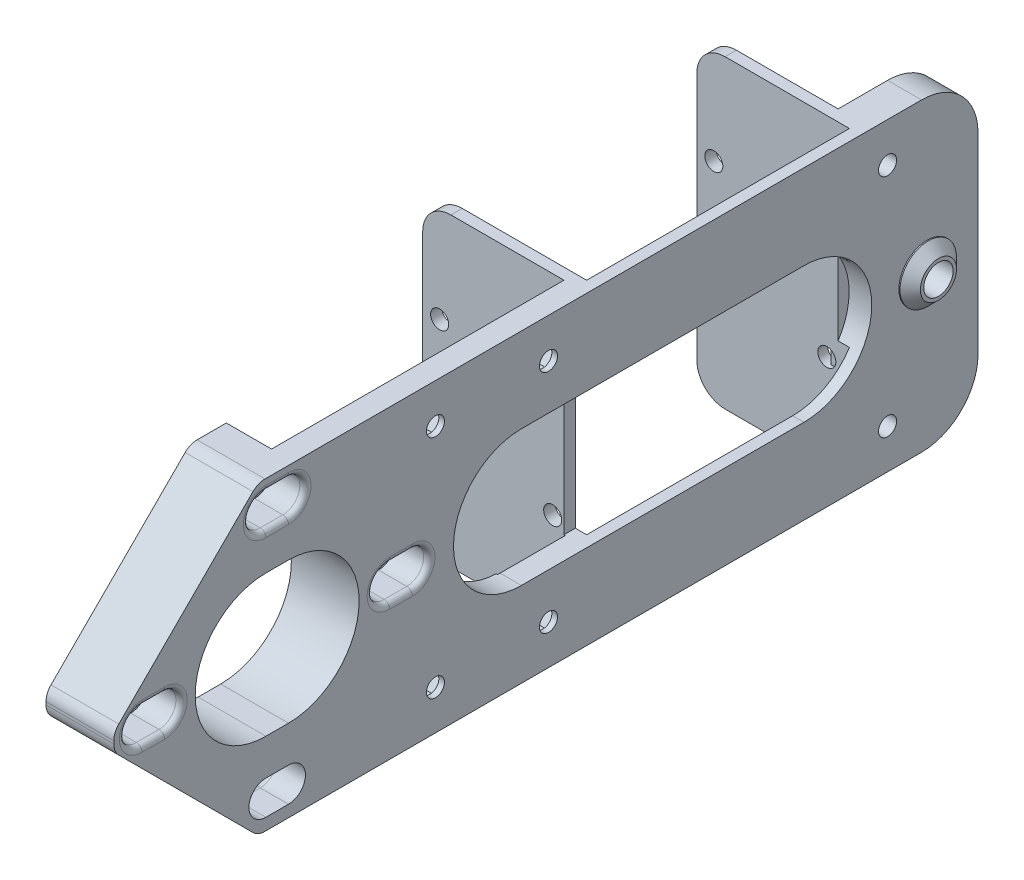
from build123d import *

# Parameters (mm, degrees)
SKETCH1_W                        = 54
SKETCH1_H                        = 154
BOSS_EXTRUDE1_DEPTH              = 2
BOSS_EXTRUDE11_REACH             = 125.016
SKETCH24_W                       = 27
SKETCH24_H                       = 2
BOSS_EXTRUDE11_DIRECTION_2_REACH = 125.016
CUT_EXTRUDE13_REACH              = 94.955
SKETCH25_R                       = 1.6
BOSS_EXTRUDE6_DEPTH              = 10
SKETCH19_W                       = 54
SKETCH19_H                       = 20
BOSS_EXTRUDE9_DEPTH              = 4
SKETCH26_W                       = 54
SKETCH26_H                       = 84.75
SKETCH26_H_2                     = 18.75
BOSS_EXTRUDE12_DEPTH             = 2
CUT_EXTRUDE3_REACH               = 128.372
SKETCH8_R                        = 1.6
CUT_EXTRUDE7_DEPTH               = 3
SKETCH18_R                       = 2.6
CUT_EXTRUDE9_DEPTH               = 6
BOSS_EXTRUDE10_START             = -2
SKETCH20_R                       = 5
SKETCH20_R_2                     = 2.6
BOSS_EXTRUDE10_DEPTH             = 2
CHAMFER3_SIZE                    = 1.8
CUT_EXTRUDE10_DEPTH              = 2.6
CUT_EXTRUDE11_DEPTH              = 4
CUT_EXTRUDE4_DEPTH               = 12
CUT_EXTRUDE5_DEPTH               = 6
FILLET6_R                        = 3
FILLET7_R                        = 1
CUT_EXTRUDE12_START              = -4
CUT_EXTRUDE12_DEPTH              = 4
SKETCH27_R                       = 3
CUT_EXTRUDE14_DEPTH              = 12
CUT_EXTRUDE15_START              = 19
SKETCH28_R                       = 3
CUT_EXTRUDE15_DEPTH              = 19
FILLET8_R                        = 5
FILLET9_R                        = 10


with BuildPart() as part:
    # Sketch1 → Boss-Extrude1 (new body)
    with BuildSketch(Plane.YZ):
        with Locations((0, 43)):
            Rectangle(SKETCH1_W, SKETCH1_H)
    extrude(amount=BOSS_EXTRUDE1_DEPTH)

    # Boss-Extrude11: up to this face of the body (flat: up to its plane)
    boss_extrude11_end = Plane(part.part.faces().sort_by_distance((1, 27, 43))[0])
    # Sketch24 → Boss-Extrude11 (add, up to the picked face)
    with BuildSketch(Plane(origin=(0, 0, 0), x_dir=(-1, 0, 0), z_dir=(0, 1, 0)), mode=Mode.PRIVATE) as boss_extrude11_sk1:
        with Locations((13.5, 34.25)):
            Rectangle(SKETCH24_W, SKETCH24_H)
    boss_extrude11_tool1 = split(extrude(boss_extrude11_sk1.sketch, amount=BOSS_EXTRUDE11_REACH, mode=Mode.PRIVATE), bisect_by=boss_extrude11_end, keep=Keep.BOTH, mode=Mode.PRIVATE)
    # Sketch24 → Boss-Extrude11 (add, up to the picked face)
    with BuildSketch(Plane(origin=(0, 0, 0), x_dir=(-1, 0, 0), z_dir=(0, 1, 0)), mode=Mode.PRIVATE) as boss_extrude11_sk2:
        with Locations((13.5, -14.25)):
            Rectangle(SKETCH24_W, SKETCH24_H)
    boss_extrude11_tool2 = split(extrude(boss_extrude11_sk2.sketch, amount=BOSS_EXTRUDE11_REACH, mode=Mode.PRIVATE), bisect_by=boss_extrude11_end, keep=Keep.BOTH, mode=Mode.PRIVATE)
    add(boss_extrude11_tool1.solids().sort_by(Axis((-13.5, 0, 34.25), (0, 1, 0)))[0])
    add(boss_extrude11_tool2.solids().sort_by(Axis((-13.5, 0, -14.25), (0, 1, 0)))[0])

    # Boss-Extrude11 direction 2: up to this face of the body (flat: up to its plane)
    boss_extrude11_direction_2_end = Plane(part.part.faces().sort_by_distance((1, -27, 43))[0])
    # Sketch24 → Boss-Extrude11 direction 2 (add, up to the picked face)
    with BuildSketch(Plane(origin=(0, 0, 0), x_dir=(-1, 0, 0), z_dir=(0, 1, 0)), mode=Mode.PRIVATE) as boss_extrude11_direction_2_sk1:
        with Locations((13.5, 34.25)):
            Rectangle(SKETCH24_W, SKETCH24_H)
    boss_extrude11_direction_2_tool1 = split(extrude(boss_extrude11_direction_2_sk1.sketch, amount=-BOSS_EXTRUDE11_DIRECTION_2_REACH, mode=Mode.PRIVATE), bisect_by=boss_extrude11_direction_2_end, keep=Keep.BOTH, mode=Mode.PRIVATE)
    # Sketch24 → Boss-Extrude11 direction 2 (add, up to the picked face)
    with BuildSketch(Plane(origin=(0, 0, 0), x_dir=(-1, 0, 0), z_dir=(0, 1, 0)), mode=Mode.PRIVATE) as boss_extrude11_direction_2_sk2:
        with Locations((13.5, -14.25)):
            Rectangle(SKETCH24_W, SKETCH24_H)
    boss_extrude11_direction_2_tool2 = split(extrude(boss_extrude11_direction_2_sk2.sketch, amount=-BOSS_EXTRUDE11_DIRECTION_2_REACH, mode=Mode.PRIVATE), bisect_by=boss_extrude11_direction_2_end, keep=Keep.BOTH, mode=Mode.PRIVATE)
    add(boss_extrude11_direction_2_tool1.solids().sort_by(Axis((-13.5, 0, 34.25), (0, -1, 0)))[0])
    add(boss_extrude11_direction_2_tool2.solids().sort_by(Axis((-13.5, 0, -14.25), (0, -1, 0)))[0])

    # Cut-Extrude13: up to this face of the body (flat: up to its plane)
    cut_extrude13_end = Plane(part.part.faces().sort_by_distance((-13.5, 0, -15.25))[0])
    # Sketch25 → Cut-Extrude13 (cut, up to the picked face)
    with BuildSketch(Plane.XY.offset(35.25), mode=Mode.PRIVATE) as cut_extrude13_sk1:
        with Locations((-24, 10)):
            Circle(SKETCH25_R)
    cut_extrude13_tool1 = split(extrude(cut_extrude13_sk1.sketch, amount=-CUT_EXTRUDE13_REACH, mode=Mode.PRIVATE), bisect_by=cut_extrude13_end, keep=Keep.BOTH, mode=Mode.PRIVATE)
    # Sketch25 → Cut-Extrude13 (cut, up to the picked face)
    with BuildSketch(Plane.XY.offset(35.25), mode=Mode.PRIVATE) as cut_extrude13_sk2:
        with Locations((-4, 10)):
            Circle(SKETCH25_R)
    cut_extrude13_tool2 = split(extrude(cut_extrude13_sk2.sketch, amount=-CUT_EXTRUDE13_REACH, mode=Mode.PRIVATE), bisect_by=cut_extrude13_end, keep=Keep.BOTH, mode=Mode.PRIVATE)
    # Sketch25 → Cut-Extrude13 (cut, up to the picked face)
    with BuildSketch(Plane.XY.offset(35.25), mode=Mode.PRIVATE) as cut_extrude13_sk3:
        with Locations((-24, -10)):
            Circle(SKETCH25_R)
    cut_extrude13_tool3 = split(extrude(cut_extrude13_sk3.sketch, amount=-CUT_EXTRUDE13_REACH, mode=Mode.PRIVATE), bisect_by=cut_extrude13_end, keep=Keep.BOTH, mode=Mode.PRIVATE)
    # Sketch25 → Cut-Extrude13 (cut, up to the picked face)
    with BuildSketch(Plane.XY.offset(35.25), mode=Mode.PRIVATE) as cut_extrude13_sk4:
        with Locations((-4, -10)):
            Circle(SKETCH25_R)
    cut_extrude13_tool4 = split(extrude(cut_extrude13_sk4.sketch, amount=-CUT_EXTRUDE13_REACH, mode=Mode.PRIVATE), bisect_by=cut_extrude13_end, keep=Keep.BOTH, mode=Mode.PRIVATE)
    add(cut_extrude13_tool1.solids().sort_by(Axis((-24, 10, 35.25), (0, 0, -1)))[0], mode=Mode.SUBTRACT)
    add(cut_extrude13_tool2.solids().sort_by(Axis((-4, 10, 35.25), (0, 0, -1)))[0], mode=Mode.SUBTRACT)
    add(cut_extrude13_tool3.solids().sort_by(Axis((-24, -10, 35.25), (0, 0, -1)))[0], mode=Mode.SUBTRACT)
    add(cut_extrude13_tool4.solids().sort_by(Axis((-4, -10, 35.25), (0, 0, -1)))[0], mode=Mode.SUBTRACT)

    # Sketch11 → Boss-Extrude6 (add)
    with BuildSketch(Plane(origin=(0, 0, 0), x_dir=(0, -1, 0), z_dir=(-1, 0, 0))):
        Polygon((-27, 96.671436241), (-27, 87), (0, 60), (27, 87), (27, 96.671436241), (3.671436241, 120), (-3.671436241, 120), align=None)
    extrude(amount=BOSS_EXTRUDE6_DEPTH)

    # Sketch19 → Boss-Extrude9 (add)
    with BuildSketch(Plane(origin=(0, 0, 0), x_dir=(0, -1, 0), z_dir=(-1, 0, 0))):
        with Locations((0, -24)):
            Rectangle(SKETCH19_W, SKETCH19_H)
    extrude(amount=BOSS_EXTRUDE9_DEPTH)

    # Sketch26 → Boss-Extrude12 (add)
    with BuildSketch(Plane(origin=(0, 0, 0), x_dir=(0, -1, 0), z_dir=(-1, 0, 0))):
        with Locations((0, 77.625)):
            Rectangle(SKETCH26_W, SKETCH26_H)
        with Locations((0, -24.625)):
            Rectangle(SKETCH26_W, SKETCH26_H_2)
    extrude(amount=BOSS_EXTRUDE12_DEPTH)

    # Cut-Extrude3: up to this face of the body (flat: up to its plane)
    cut_extrude3_end = Plane(part.part.faces().sort_by_distance((-10, 0, 91.634304872))[0])
    # Sketch8 → Cut-Extrude3 (cut, up to the picked face)
    with BuildSketch(Plane.YZ.offset(2), mode=Mode.PRIVATE) as cut_extrude3_sk1:
        with Locations(Location((-20, 62, 0), (0, 0, 270))):
            Circle(SKETCH8_R)
    cut_extrude3_tool1 = split(extrude(cut_extrude3_sk1.sketch, amount=-CUT_EXTRUDE3_REACH, mode=Mode.PRIVATE), bisect_by=cut_extrude3_end, keep=Keep.BOTH, mode=Mode.PRIVATE)
    # Sketch8 → Cut-Extrude3 (cut, up to the picked face)
    with BuildSketch(Plane.YZ.offset(2), mode=Mode.PRIVATE) as cut_extrude3_sk2:
        with Locations(Location((-20, 42, 0), (0, 0, 270))):
            Circle(SKETCH8_R)
    cut_extrude3_tool2 = split(extrude(cut_extrude3_sk2.sketch, amount=-CUT_EXTRUDE3_REACH, mode=Mode.PRIVATE), bisect_by=cut_extrude3_end, keep=Keep.BOTH, mode=Mode.PRIVATE)
    # Sketch8 → Cut-Extrude3 (cut, up to the picked face)
    with BuildSketch(Plane.YZ.offset(2), mode=Mode.PRIVATE) as cut_extrude3_sk3:
        with Locations(Location((-20, -18, 0), (0, 0, 270))):
            Circle(SKETCH8_R)
    cut_extrude3_tool3 = split(extrude(cut_extrude3_sk3.sketch, amount=-CUT_EXTRUDE3_REACH, mode=Mode.PRIVATE), bisect_by=cut_extrude3_end, keep=Keep.BOTH, mode=Mode.PRIVATE)
    # Sketch8 → Cut-Extrude3 (cut, up to the picked face)
    with BuildSketch(Plane.YZ.offset(2), mode=Mode.PRIVATE) as cut_extrude3_sk4:
        with Locations(Location((20, -18, 0), (0, 0, 270))):
            Circle(SKETCH8_R)
    cut_extrude3_tool4 = split(extrude(cut_extrude3_sk4.sketch, amount=-CUT_EXTRUDE3_REACH, mode=Mode.PRIVATE), bisect_by=cut_extrude3_end, keep=Keep.BOTH, mode=Mode.PRIVATE)
    # Sketch8 → Cut-Extrude3 (cut, up to the picked face)
    with BuildSketch(Plane.YZ.offset(2), mode=Mode.PRIVATE) as cut_extrude3_sk5:
        with Locations(Location((20, 42, 0), (0, 0, 270))):
            Circle(SKETCH8_R)
    cut_extrude3_tool5 = split(extrude(cut_extrude3_sk5.sketch, amount=-CUT_EXTRUDE3_REACH, mode=Mode.PRIVATE), bisect_by=cut_extrude3_end, keep=Keep.BOTH, mode=Mode.PRIVATE)
    # Sketch8 → Cut-Extrude3 (cut, up to the picked face)
    with BuildSketch(Plane.YZ.offset(2), mode=Mode.PRIVATE) as cut_extrude3_sk6:
        with Locations(Location((20, 62, 0), (0, 0, 270))):
            Circle(SKETCH8_R)
    cut_extrude3_tool6 = split(extrude(cut_extrude3_sk6.sketch, amount=-CUT_EXTRUDE3_REACH, mode=Mode.PRIVATE), bisect_by=cut_extrude3_end, keep=Keep.BOTH, mode=Mode.PRIVATE)
    add(cut_extrude3_tool1.solids().sort_by(Axis((2, -20, 62), (-1, 0, 0)))[0], mode=Mode.SUBTRACT)
    add(cut_extrude3_tool2.solids().sort_by(Axis((2, -20, 42), (-1, 0, 0)))[0], mode=Mode.SUBTRACT)
    add(cut_extrude3_tool3.solids().sort_by(Axis((2, -20, -18), (-1, 0, 0)))[0], mode=Mode.SUBTRACT)
    add(cut_extrude3_tool4.solids().sort_by(Axis((2, 20, -18), (-1, 0, 0)))[0], mode=Mode.SUBTRACT)
    add(cut_extrude3_tool5.solids().sort_by(Axis((2, 20, 42), (-1, 0, 0)))[0], mode=Mode.SUBTRACT)
    add(cut_extrude3_tool6.solids().sort_by(Axis((2, 20, 62), (-1, 0, 0)))[0], mode=Mode.SUBTRACT)

    # Sketch16 → Cut-Extrude7 (cut)
    with BuildSketch(Plane(origin=(-2, 0, 0), x_dir=(0, -1, 0), z_dir=(-1, 0, 0))):
        Polygon((-17, 60.267949192), (-17, 63.732050808), (-20, 65.464101615), (-23, 63.732050808), (-23, 60.267949192), (-20, 58.535898385), align=None)
        Polygon((-17, 40.267949192), (-17, 43.732050808), (-20, 45.464101615), (-23, 43.732050808), (-23, 40.267949192), (-20, 38.535898385), align=None)
        Polygon((23, 40.267949192), (23, 43.732050808), (20, 45.464101615), (17, 43.732050808), (17, 40.267949192), (20, 38.535898385), align=None)
        Polygon((23, 60.267949192), (23, 63.732050808), (20, 65.464101615), (17, 63.732050808), (17, 60.267949192), (20, 58.535898385), align=None)
    extrude(amount=-CUT_EXTRUDE7_DEPTH, mode=Mode.SUBTRACT)

    # Sketch18 → Cut-Extrude9 (cut)
    with BuildSketch(Plane.YZ.offset(2)):
        with Locations(Location((0, -25, 0), (0, 0, 270))):
            Circle(SKETCH18_R)
    extrude(amount=-CUT_EXTRUDE9_DEPTH, mode=Mode.SUBTRACT)

    # Sketch20 → Boss-Extrude10 (add)
    with BuildSketch(Plane(origin=(2, 0, 0), x_dir=(0, -1, 0), z_dir=(-1, 0, 0)).offset(BOSS_EXTRUDE10_START)):
        with Locations(Location((0, -25, 0), (0, 0, 90))):
            Circle(SKETCH20_R)
        with Locations(Location((0, -25, 0), (0, 0, 270))):
            Circle(SKETCH20_R_2, mode=Mode.SUBTRACT)
    extrude(amount=BOSS_EXTRUDE10_DEPTH)

    # Chamfer3
    chamfer3_edges = [part.edges().sort_by_distance(p)[0] for p in [
        (4, 0, -30),
    ]]
    chamfer(chamfer3_edges, length=CHAMFER3_SIZE)

    # Sketch21 → Cut-Extrude10 (cut)
    with BuildSketch(Plane(origin=(-4, 0, 0), x_dir=(0, -1, 0), z_dir=(-1, 0, 0))):
        Polygon((-18.267949192, -15), (-21.732050808, -15), (-23.464101615, -18), (-21.732050808, -21), (-18.267949192, -21), (-16.535898385, -18), align=None)
        Polygon((21.732050808, -15), (18.267949192, -15), (16.535898385, -18), (18.267949192, -21), (21.732050808, -21), (23.464101615, -18), align=None)
    extrude(amount=-CUT_EXTRUDE10_DEPTH, mode=Mode.SUBTRACT)

    # Sketch22 → Cut-Extrude11 (cut)
    with BuildSketch(Plane(origin=(-4, 0, 0), x_dir=(0, -1, 0), z_dir=(-1, 0, 0))):
        Polygon((2.33826859, -20.95), (-2.33826859, -20.95), (-4.67653718, -25), (-2.33826859, -29.05), (2.33826859, -29.05), (4.67653718, -25), align=None)
    extrude(amount=-CUT_EXTRUDE11_DEPTH, mode=Mode.SUBTRACT)

    # Sketch9 → Cut-Extrude4 (cut)
    with BuildSketch(Plane.YZ.offset(2)):
        Polygon((-38.797637671, 81.60795392), (-1.5, 118.905591591), (1.5, 118.905591591), (38.797637671, 81.60795392), (38.797637671, 127.651819011), (-38.797637671, 127.651819011), align=None)
        with BuildLine():
            Line((-12.5, 88), (-12.5, 92))
            ThreePointArc((-12.5, 92), (0, 104.5), (12.5, 92))
            Line((12.5, 92), (12.5, 88))
            ThreePointArc((12.5, 88), (0, 75.5), (-12.5, 88))
        make_face()
        with BuildLine():
            Line((-1.479986442, 109.920310217), (-1.479986442, 113.920310217))
            ThreePointArc((-1.479986442, 113.920310217), (0, 115.400296658), (1.479986442, 113.920310217))
            Line((1.479986442, 113.920310217), (1.479986442, 109.920310217))
            ThreePointArc((1.479986442, 109.920310217), (0, 108.440323775), (-1.479986442, 109.920310217))
        make_face()
        with BuildLine():
            Line((-23.400296658, 88), (-23.400296658, 92))
            ThreePointArc((-23.400296658, 92), (-21.920310217, 93.479986442), (-20.440323775, 92))
            Line((-20.440323775, 92), (-20.440323775, 88))
            ThreePointArc((-20.440323775, 88), (-21.920310217, 86.520013558), (-23.400296658, 88))
        make_face()
        with BuildLine():
            Line((-1.479986442, 66.079689783), (-1.479986442, 70.079689783))
            ThreePointArc((-1.479986442, 70.079689783), (0, 71.559676225), (1.479986442, 70.079689783))
            Line((1.479986442, 70.079689783), (1.479986442, 66.079689783))
            ThreePointArc((1.479986442, 66.079689783), (0, 64.599703342), (-1.479986442, 66.079689783))
        make_face()
        with BuildLine():
            Line((20.440323775, 88), (20.440323775, 92))
            ThreePointArc((20.440323775, 92), (21.920310217, 93.479986442), (23.400296658, 92))
            Line((23.400296658, 92), (23.400296658, 88))
            ThreePointArc((23.400296658, 88), (21.920310217, 86.520013558), (20.440323775, 88))
        make_face()
    extrude(amount=-CUT_EXTRUDE4_DEPTH, mode=Mode.SUBTRACT)

    # Sketch12 → Cut-Extrude5 (cut)
    with BuildSketch(Plane.YZ.offset(2)):
        with BuildLine():
            Line((-24.920310217, 88), (-24.920310217, 92))
            ThreePointArc((-24.920310217, 92), (-21.920310217, 95), (-18.920310217, 92))
            Line((-18.920310217, 92), (-18.920310217, 88))
            ThreePointArc((-18.920310217, 88), (-21.920310217, 85), (-24.920310217, 88))
        make_face()
        with BuildLine():
            Line((-3, 109.920310217), (-3, 113.920310217))
            ThreePointArc((-3, 113.920310217), (0, 116.920310217), (3, 113.920310217))
            Line((3, 113.920310217), (3, 109.920310217))
            ThreePointArc((3, 109.920310217), (0, 106.920310217), (-3, 109.920310217))
        make_face()
        with BuildLine():
            Line((18.920310217, 88), (18.920310217, 92))
            ThreePointArc((18.920310217, 92), (21.920310217, 95), (24.920310217, 92))
            Line((24.920310217, 92), (24.920310217, 88))
            ThreePointArc((24.920310217, 88), (21.920310217, 85), (18.920310217, 88))
        make_face()
        with BuildLine():
            Line((-3, 66.079689783), (-3, 70.079689783))
            ThreePointArc((-3, 70.079689783), (0, 73.079689783), (3, 70.079689783))
            Line((3, 70.079689783), (3, 66.079689783))
            ThreePointArc((3, 66.079689783), (0, 63.079689783), (-3, 66.079689783))
        make_face()
    extrude(amount=-CUT_EXTRUDE5_DEPTH, mode=Mode.SUBTRACT)

    # Fillet6
    fillet6_edges = [part.edges().sort_by_distance(p)[0] for p in [
        (-4, 27, 93.405591591),
        (-4, -27, 93.405591591),
        (-4, -1.5, 118.905591591),
        (-4, 1.5, 118.905591591),
    ]]
    fillet(fillet6_edges, radius=FILLET6_R)

    # Fillet7
    fillet7_edges = [part.edges().sort_by_distance(p)[0] for p in [
        (-4, -18.920310217, 90),
        (-4, -21.920310217, 95),
        (-4, -24.920310217, 90),
        (-4, -21.920310217, 85),
        (2, 0, 106.920310217),
        (2, 3, 111.920310217),
        (2, 0, 116.920310217),
        (2, -3, 111.920310217),
        (2, 21.920310217, 85),
        (2, 24.920310217, 90),
        (2, 21.920310217, 95),
        (2, 18.920310217, 90),
        (2, 0, 63.079689783),
        (2, 3, 68.079689783),
        (2, 0, 73.079689783),
        (2, -3, 68.079689783),
    ]]
    fillet(fillet7_edges, radius=FILLET7_R)

    # Sketch23 → Cut-Extrude12 (cut)
    with BuildSketch(Plane.YZ.offset(2).offset(CUT_EXTRUDE12_START)):
        with BuildLine():
            Line((12, 46.80321691), (12, -3.19678309))
            ThreePointArc((12, -3.19678309), (0, -15.19678309), (-12, -3.19678309))
            Line((-12, -3.19678309), (-12, 46.80321691))
            ThreePointArc((-12, 46.80321691), (0, 58.80321691), (12, 46.80321691))
        make_face()
    extrude(amount=CUT_EXTRUDE12_DEPTH, mode=Mode.SUBTRACT)

    # Sketch27 → Cut-Extrude14 (cut)
    with BuildSketch(Plane.XY.offset(35.25)):
        with Locations((-24, 10)):
            Circle(SKETCH27_R)
        with Locations((-24, -10)):
            Circle(SKETCH27_R)
        with Locations((-4, 10)):
            Circle(SKETCH27_R)
        with Locations((-4, -10)):
            Circle(SKETCH27_R)
    extrude(amount=CUT_EXTRUDE14_DEPTH, mode=Mode.SUBTRACT)

    # Sketch28 → Cut-Extrude15 (cut)
    with BuildSketch(Plane(origin=(0, 0, -15), x_dir=(1, 0, 0), z_dir=(0, 0, -1)).offset(CUT_EXTRUDE15_START)):
        with Locations(Location((-4, 10, 0), (0, 0, 90))):
            Circle(SKETCH28_R)
        with Locations(Location((-4, -10, 0), (0, 0, 90))):
            Circle(SKETCH28_R)
    extrude(amount=-CUT_EXTRUDE15_DEPTH, mode=Mode.SUBTRACT)

    # Fillet8
    fillet8_edges = [part.edges().sort_by_distance(p)[0] for p in [
        (-27, 27, -14.25),
        (-27, -27, -14.25),
        (-27, 27, 34.25),
        (-27, -27, 34.25),
    ]]
    fillet(fillet8_edges, radius=FILLET8_R)

    # Fillet9
    fillet9_edges = [part.edges().sort_by_distance(p)[0] for p in [
        (-1, 27, -34),
        (-1, -27, -34),
    ]]
    fillet(fillet9_edges, radius=FILLET9_R)


solid = part.part
